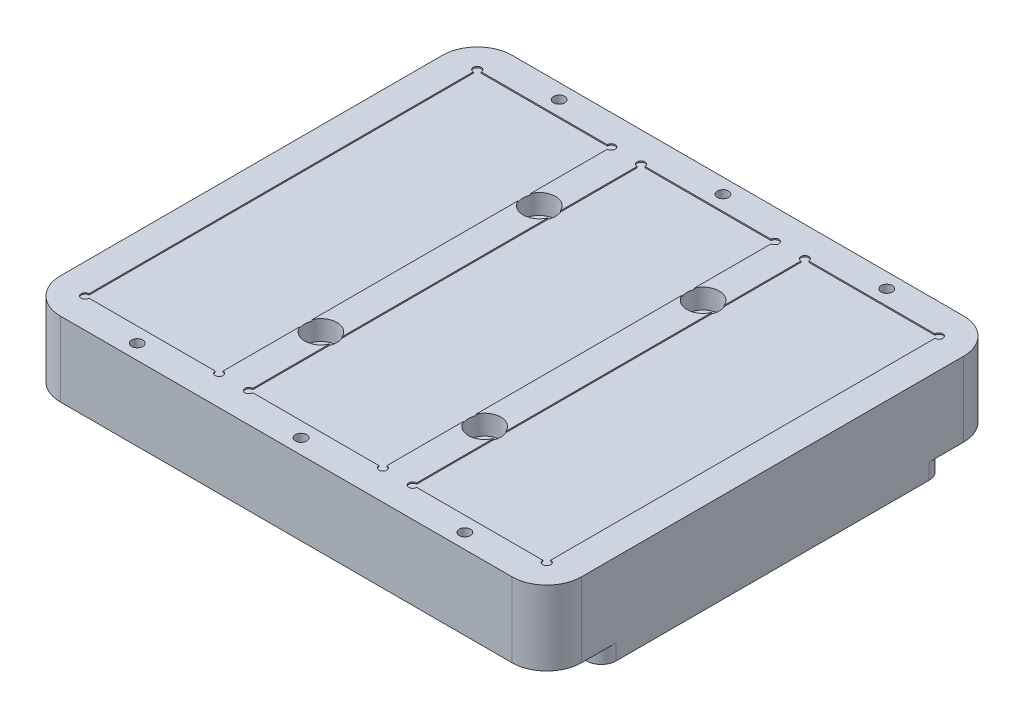
from build123d import *

# Parameters (mm, degrees)
SKETCH1_W                      = 105
SKETCH1_H                      = 69
BOSS_EXTRUDE1_DEPTH            = 3.18
FILLET1_R                      = 3
SKETCH2_W                      = 105
SKETCH2_H                      = 91
BOSS_EXTRUDE2_DEPTH            = 15
FILLET2_R                      = 7
SKETCH3_W                      = 27
SKETCH3_H                      = 79
CUT_EXTRUDE1_DEPTH             = 0.25
SKETCH4_R                      = 0.79375
CUT_EXTRUDE2_DEPTH             = 0.25
MIRROR2_COPY_1_SKETCH_R        = 0.79375
MIRROR2_COPY_1_DEPTH           = 0.25
LPATTERN1_COUNT                = 3
LPATTERN1_PITCH                = 33
LPATTERN1_COPY_3_SKETCH_R      = 0.79375
LPATTERN1_COPY_3_DEPTH         = 0.25
LPATTERN1_COPY_4_SKETCH_R      = 0.79375
LPATTERN1_COPY_4_DEPTH         = 0.25
LPATTERN1_COPY_5_SKETCH_R      = 0.79375
LPATTERN1_COPY_5_DEPTH         = 0.25
LPATTERN1_COPY_6_SKETCH_R      = 0.79375
LPATTERN1_COPY_6_DEPTH         = 0.25
LPATTERN1_COPY_7_SKETCH_R      = 0.79375
LPATTERN1_COPY_7_DEPTH         = 0.25
LPATTERN1_COPY_8_SKETCH_R      = 0.79375
LPATTERN1_COPY_8_DEPTH         = 0.25
CBORE_FOR_M3_SHCS1_D           = 3.4
CBORE_FOR_M3_SHCS1_CBORE_D     = 6.5
CBORE_FOR_M3_SHCS1_CBORE_DEPTH = 4
MIRROR4_COPY_1_D               = 3.4
MIRROR4_COPY_1_CBORE_D         = 6.5
MIRROR4_COPY_1_CBORE_DEPTH     = 4
F_2_56_TAPPED_HOLE1_AT_2_COUNT = 2
F_2_56_TAPPED_HOLE1_AT_2_PITCH = 6
LPATTERN2_COUNT                = 3
LPATTERN2_PITCH                = 33


with BuildPart() as part:
    # Sketch1 → Boss-Extrude1 (new body)
    with BuildSketch(Plane(origin=(0, 0, 0), x_dir=(1, 0, 0), z_dir=(0, 1, 0))):
        Rectangle(SKETCH1_W, SKETCH1_H)
    extrude(amount=BOSS_EXTRUDE1_DEPTH)

    # Fillet1
    fillet1_edges = [part.edges().sort_by_distance(p)[0] for p in [
        (52.5, 1.59, 34.5),
        (-52.5, 1.59, 34.5),
        (-52.5, 1.59, -34.5),
        (52.5, 1.59, -34.5),
    ]]
    fillet(fillet1_edges, radius=FILLET1_R)

    # Sketch2 → Boss-Extrude2 (add)
    with BuildSketch(Plane(origin=(0, 3.18, 0), x_dir=(1, 0, 0), z_dir=(0, 1, 0))):
        Rectangle(SKETCH2_W, SKETCH2_H)
    extrude(amount=BOSS_EXTRUDE2_DEPTH)

    # Fillet2
    fillet2_edges = [part.edges().sort_by_distance(p)[0] for p in [
        (52.5, 10.68, 45.5),
        (52.5, 10.68, -45.5),
        (-52.5, 10.68, -45.5),
        (-52.5, 10.68, 45.5),
    ]]
    fillet(fillet2_edges, radius=FILLET2_R)

    # Sketch3 → Cut-Extrude1 (cut)
    with BuildSketch(Plane(origin=(0, 18.18, 0), x_dir=(1, 0, 0), z_dir=(0, 1, 0))):
        with Locations((-33, 0)):
            Rectangle(SKETCH3_W, SKETCH3_H)
    cut_extrude1 = extrude(amount=-CUT_EXTRUDE1_DEPTH, mode=Mode.SUBTRACT)

    # Sketch8 → #4-40 Tapped Hole1 (revolve, cut)
    with BuildSketch(Plane(origin=(-33, 18.18, -42.5), x_dir=(0, 0, 1), z_dir=(1, 0, 0))):
        Polygon((0, 0), (0, 7.679152758), (1.1303, 7), (1.1303, 0), align=None)
    f_4_40_tapped_hole1 = revolve(axis=Axis((-33, 24.53, -42.5), (0, -1, 0)), mode=Mode.SUBTRACT)

    # Mirror5: #4-40 Tapped Hole1 across plane
    add(f_4_40_tapped_hole1.mirror(Plane.XY), mode=Mode.SUBTRACT)

    # Sketch4 → Cut-Extrude2 (cut)
    with BuildSketch(Plane(origin=(0, 18.18, 0), x_dir=(1, 0, 0), z_dir=(0, 1, 0))):
        with Locations((-46.5, 39.5)):
            Circle(SKETCH4_R)
    cut_extrude2 = extrude(amount=-CUT_EXTRUDE2_DEPTH, mode=Mode.SUBTRACT)

    # Mirror1: Cut-Extrude2 across plane
    add(cut_extrude2.mirror(Plane(origin=(-33, 0, 0), x_dir=(0, 0, 1), z_dir=(1, 0, 0))), mode=Mode.SUBTRACT)

    # Mirror2: Cut-Extrude2 across plane
    add(cut_extrude2.mirror(Plane.XY), mode=Mode.SUBTRACT)

    # Mirror2 copy 1 sketch → Mirror2 copy 1 (cut)
    with BuildSketch(Plane(origin=(-66, 18.18, 0), x_dir=(-1, 0, 0), z_dir=(0, 1, 0))):
        with Locations((-46.5, 39.5)):
            Circle(MIRROR2_COPY_1_SKETCH_R)
    extrude(amount=-MIRROR2_COPY_1_DEPTH, mode=Mode.SUBTRACT)

    # LPattern1: Cut-Extrude1, #4-40 Tapped Hole1, Cut-Extrude2 ×3
    with Locations(*[(i * LPATTERN1_PITCH, 0, 0) for i in range(1, LPATTERN1_COUNT)]):
        add(cut_extrude1, mode=Mode.SUBTRACT)
        add(f_4_40_tapped_hole1, mode=Mode.SUBTRACT)
        add(cut_extrude2, mode=Mode.SUBTRACT)

    # LPattern1 copy 1 sketch → LPattern1 copy 1 (revolve, cut)
    with BuildSketch(Plane(origin=(0, 18.18, 42.5), x_dir=(0, 0, -1), z_dir=(1, 0, 0))):
        Polygon((0, 0), (0, -7.679152758), (1.1303, -7), (1.1303, 0), align=None)
    revolve(axis=Axis((0, 24.53, 42.5), (0, 1, 0)), mode=Mode.SUBTRACT)

    # LPattern1 copy 2 sketch → LPattern1 copy 2 (revolve, cut)
    with BuildSketch(Plane(origin=(33, 18.18, 42.5), x_dir=(0, 0, -1), z_dir=(1, 0, 0))):
        Polygon((0, 0), (0, -7.679152758), (1.1303, -7), (1.1303, 0), align=None)
    revolve(axis=Axis((33, 24.53, 42.5), (0, 1, 0)), mode=Mode.SUBTRACT)

    # LPattern1 copy 3 sketch → LPattern1 copy 3 (cut)
    with BuildSketch(Plane(origin=(-33, 18.18, 0), x_dir=(-1, 0, 0), z_dir=(0, 1, 0))):
        with Locations((-46.5, -39.5)):
            Circle(LPATTERN1_COPY_3_SKETCH_R)
    extrude(amount=-LPATTERN1_COPY_3_DEPTH, mode=Mode.SUBTRACT)

    # LPattern1 copy 4 sketch → LPattern1 copy 4 (cut)
    with BuildSketch(Plane(origin=(0, 18.18, 0), x_dir=(-1, 0, 0), z_dir=(0, 1, 0))):
        with Locations((-46.5, -39.5)):
            Circle(LPATTERN1_COPY_4_SKETCH_R)
    extrude(amount=-LPATTERN1_COPY_4_DEPTH, mode=Mode.SUBTRACT)

    # LPattern1 copy 5 sketch → LPattern1 copy 5 (cut)
    with BuildSketch(Plane(origin=(33, 18.18, 0), x_dir=(1, 0, 0), z_dir=(0, 1, 0))):
        with Locations((-46.5, -39.5)):
            Circle(LPATTERN1_COPY_5_SKETCH_R)
    extrude(amount=-LPATTERN1_COPY_5_DEPTH, mode=Mode.SUBTRACT)

    # LPattern1 copy 6 sketch → LPattern1 copy 6 (cut)
    with BuildSketch(Plane(origin=(66, 18.18, 0), x_dir=(1, 0, 0), z_dir=(0, 1, 0))):
        with Locations((-46.5, -39.5)):
            Circle(LPATTERN1_COPY_6_SKETCH_R)
    extrude(amount=-LPATTERN1_COPY_6_DEPTH, mode=Mode.SUBTRACT)

    # LPattern1 copy 7 sketch → LPattern1 copy 7 (cut)
    with BuildSketch(Plane(origin=(-33, 18.18, 0), x_dir=(-1, 0, 0), z_dir=(0, 1, 0))):
        with Locations((-46.5, 39.5)):
            Circle(LPATTERN1_COPY_7_SKETCH_R)
    extrude(amount=-LPATTERN1_COPY_7_DEPTH, mode=Mode.SUBTRACT)

    # LPattern1 copy 8 sketch → LPattern1 copy 8 (cut)
    with BuildSketch(Plane(origin=(0, 18.18, 0), x_dir=(-1, 0, 0), z_dir=(0, 1, 0))):
        with Locations((-46.5, 39.5)):
            Circle(LPATTERN1_COPY_8_SKETCH_R)
    extrude(amount=-LPATTERN1_COPY_8_DEPTH, mode=Mode.SUBTRACT)

    # CBORE for M3 SHCS1 (through all)
    with Locations(Plane(origin=(0, 18.18, 0), x_dir=(1, 0, 0), z_dir=(0, 1, 0))):
        with Locations((16.5, -22)):
            cbore_for_m3_shcs1 = CounterBoreHole(CBORE_FOR_M3_SHCS1_D / 2, CBORE_FOR_M3_SHCS1_CBORE_D / 2, CBORE_FOR_M3_SHCS1_CBORE_DEPTH)

    # Mirror3: CBORE for M3 SHCS1 across plane
    add(cbore_for_m3_shcs1.mirror(Plane(origin=(0, 0, 0), x_dir=(0, 0, 1), z_dir=(1, 0, 0))), mode=Mode.SUBTRACT)

    # Mirror4: CBORE for M3 SHCS1 across plane
    add(cbore_for_m3_shcs1.mirror(Plane.XY), mode=Mode.SUBTRACT)

    # Mirror4 copy 1 (through all)
    with Locations(Plane(origin=(0, 18.18, 0), x_dir=(-1, 0, 0), z_dir=(0, 1, 0))):
        with Locations((16.5, -22)):
            CounterBoreHole(MIRROR4_COPY_1_D / 2, MIRROR4_COPY_1_CBORE_D / 2, MIRROR4_COPY_1_CBORE_DEPTH)

    # Sketch10 → #2-56 Tapped Hole1 (revolve, cut)
    with BuildSketch(Plane(origin=(-30, 12.18, -45.5), x_dir=(0, 1, 0), z_dir=(1, 0, 0))):
        Polygon((0, 0), (0, 6.26416509), (0.889, 5.73), (0.889, 0), align=None)
    f_2_56_tapped_hole1 = revolve(axis=Axis((-30, 12.18, -51.85), (0, 0, 1)), mode=Mode.SUBTRACT)

    # #2-56 Tapped Hole1 at 2: #2-56 Tapped Hole1 ×2
    with Locations(*[(-i * F_2_56_TAPPED_HOLE1_AT_2_PITCH, 0, 0) for i in range(1, F_2_56_TAPPED_HOLE1_AT_2_COUNT)]):
        add(f_2_56_tapped_hole1, mode=Mode.SUBTRACT)

    # LPattern2: #2-56 Tapped Hole1 ×3
    with Locations(*[(i * LPATTERN2_PITCH, 0, 0) for i in range(1, LPATTERN2_COUNT)]):
        add(f_2_56_tapped_hole1, mode=Mode.SUBTRACT)

    # LPattern2 copy 1 sketch → LPattern2 copy 1 (revolve, cut)
    with BuildSketch(Plane(origin=(-3, 12.18, -45.5), x_dir=(0, 1, 0), z_dir=(1, 0, 0))):
        Polygon((0, 0), (0, 6.26416509), (0.889, 5.73), (0.889, 0), align=None)
    revolve(axis=Axis((-3, 12.18, -51.85), (0, 0, 1)), mode=Mode.SUBTRACT)

    # LPattern2 copy 2 sketch → LPattern2 copy 2 (revolve, cut)
    with BuildSketch(Plane(origin=(30, 12.18, -45.5), x_dir=(0, 1, 0), z_dir=(1, 0, 0))):
        Polygon((0, 0), (0, 6.26416509), (0.889, 5.73), (0.889, 0), align=None)
    revolve(axis=Axis((30, 12.18, -51.85), (0, 0, 1)), mode=Mode.SUBTRACT)


solid = part.part
